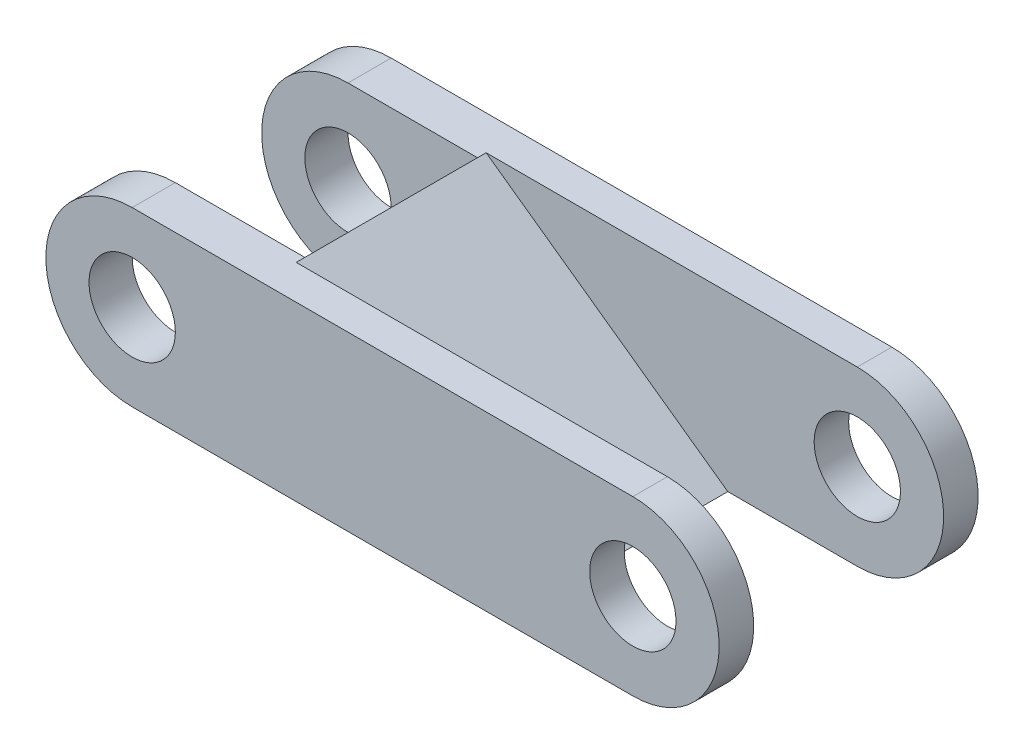
from build123d import *

# Parameters (mm, degrees)
SKETCH1_R                      = 5
BOSS_EXTRUDE1_DEPTH            = 30
SKETCH2_W                      = 25
SKETCH2_H                      = 20
SKETCH2_H_2                    = 22
CUT_EXTRUDE1_DEPTH             = 77.962109955
CUT_EXTRUDE2_DEPTH             = 20
CUT_EXTRUDE3_REACH             = 75.131
CUT_EXTRUDE3_DIRECTION_2_REACH = 75.131


with BuildPart() as part:
    # Sketch1 → Boss-Extrude1 (new body)
    with BuildSketch(Plane.XY):
        with BuildLine():
            Line((0, 10), (57.993870082, 10))
            ThreePointArc((57.993870082, 10), (67.993870082, 0), (57.993870082, -10))
            Line((57.993870082, -10), (0, -10))
            ThreePointArc((0, -10), (-10, 0), (0, 10))
        make_face()
        Circle(SKETCH1_R, mode=Mode.SUBTRACT)
        with Locations((57.993870082, 0)):
            Circle(SKETCH1_R, mode=Mode.SUBTRACT)
    extrude(amount=BOSS_EXTRUDE1_DEPTH)

    # Sketch2 → Cut-Extrude1 (cut, through all)
    with BuildSketch(Plane(origin=(0, 10, 0), x_dir=(1, 0, 0), z_dir=(0, 1, 0))):
        with Locations((2.5, -15)):
            Rectangle(SKETCH2_W, SKETCH2_H)
        with Locations((55.493870082, -15)):
            Rectangle(SKETCH2_W, SKETCH2_H_2)
    extrude(amount=-CUT_EXTRUDE1_DEPTH, mode=Mode.SUBTRACT)

    # Sketch4 → Cut-Extrude2 (cut)
    with BuildSketch(Plane.XY.offset(5)):
        Polygon((15, 10), (42.993870082, 10), (42.993870082, -10), align=None)
    extrude(amount=CUT_EXTRUDE2_DEPTH, mode=Mode.SUBTRACT)

    # Cut-Extrude3: up to this face of the body (flat: up to its plane)
    cut_extrude3_end = Plane(part.part.faces().sort_by_distance((50.493870082, 9.679843788, 4))[0])
    # Sketch5 → Cut-Extrude3 (cut, up to the picked face)
    with BuildSketch(Plane.XY.offset(5), mode=Mode.PRIVATE) as cut_extrude3_sk1:
        Polygon((15, 10), (42.993870082, -10), (42.993870082, 10), align=None)
    cut_extrude3_tool1 = split(extrude(cut_extrude3_sk1.sketch, amount=-CUT_EXTRUDE3_REACH, mode=Mode.PRIVATE), bisect_by=cut_extrude3_end, keep=Keep.BOTH, mode=Mode.PRIVATE)
    add(cut_extrude3_tool1.solids().sort_by(Axis((33.66258, 3.333333, 5), (0, 0, -1)))[0], mode=Mode.SUBTRACT)

    # Cut-Extrude3 direction 2: up to this face of the body (flat: up to its plane)
    cut_extrude3_direction_2_end = Plane(part.part.faces().sort_by_distance((50.493870082, 9.679843788, 26))[0])
    # Sketch5 → Cut-Extrude3 direction 2 (cut, up to the picked face)
    with BuildSketch(Plane.XY.offset(5), mode=Mode.PRIVATE) as cut_extrude3_direction_2_sk1:
        Polygon((15, 10), (42.993870082, -10), (42.993870082, 10), align=None)
    cut_extrude3_direction_2_tool1 = split(extrude(cut_extrude3_direction_2_sk1.sketch, amount=CUT_EXTRUDE3_DIRECTION_2_REACH, mode=Mode.PRIVATE), bisect_by=cut_extrude3_direction_2_end, keep=Keep.BOTH, mode=Mode.PRIVATE)
    add(cut_extrude3_direction_2_tool1.solids().sort_by(Axis((33.66258, 3.333333, 5), (0, 0, 1)))[0], mode=Mode.SUBTRACT)


solid = part.part
